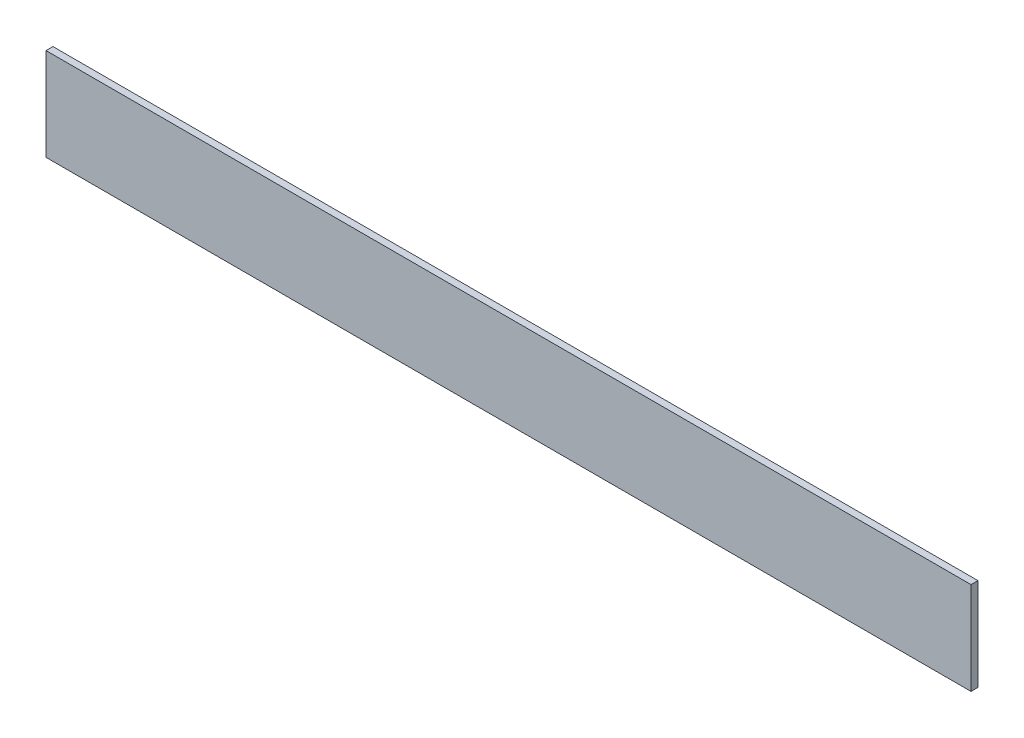
from build123d import *

# Parameters (mm, degrees)
SKETCH1_W      = 1016
SKETCH1_H      = 101.6
EXTRUDE1_DEPTH = 7.62


with BuildPart() as part:
    # Sketch1 → Extrude1 (new body)
    with BuildSketch(Plane.XY):
        with Locations((459.266666667, 25.866666667)):
            Rectangle(SKETCH1_W, SKETCH1_H)
    extrude(amount=EXTRUDE1_DEPTH)


solid = part.part
